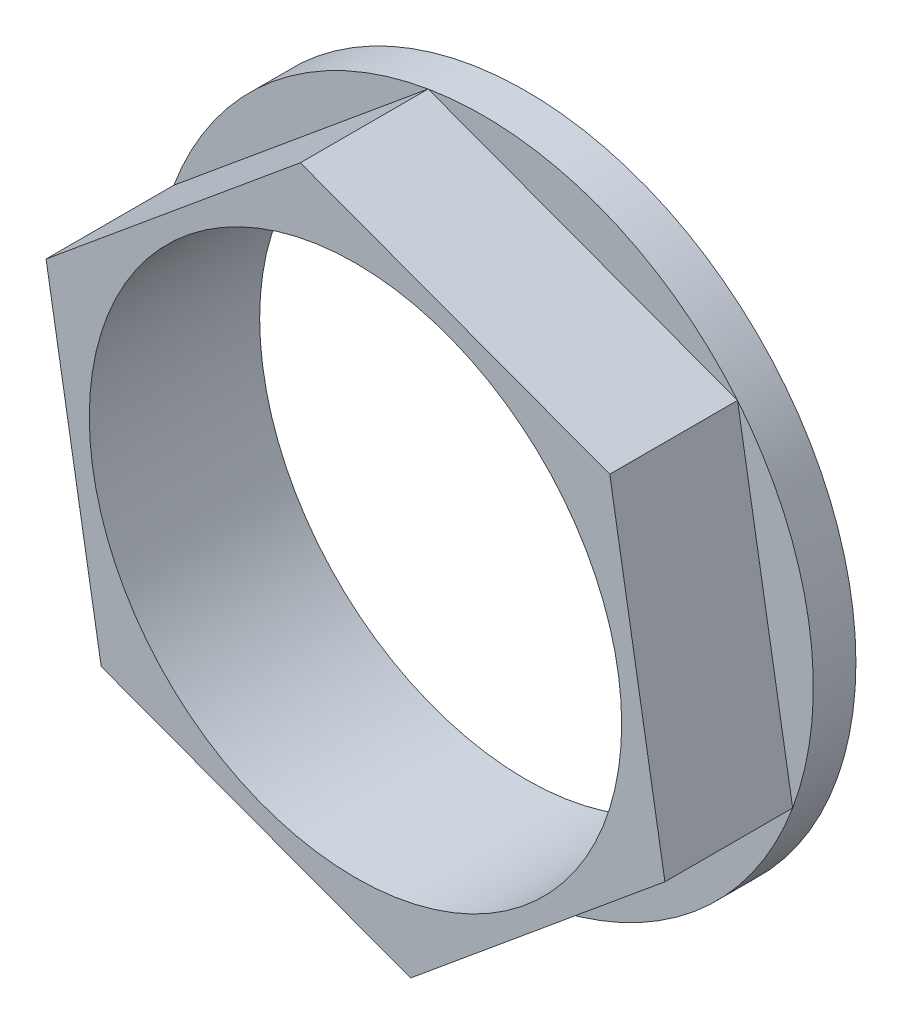
from build123d import *

# Parameters (mm, degrees)
ESBO_O1_R                = 7.75
ESBO_O1_R_2              = 6.25
RESSALTO_EXTRUS_O1_DEPTH = 1
ESBO_O2_R                = 6.25
RESSALTO_EXTRUS_O2_DEPTH = 3


with BuildPart() as part:
    # Esboço1 → Ressalto-extrusão1 (new body)
    with BuildSketch(Plane.XY):
        Circle(ESBO_O1_R)
        Circle(ESBO_O1_R_2, mode=Mode.SUBTRACT)
    extrude(amount=RESSALTO_EXTRUS_O1_DEPTH)

    # Esboço2 → Ressalto-extrusão2 (add)
    with BuildSketch(Plane.XY.offset(1)):
        Polygon((-7.264588002, 2.699677974), (-5.970283708, -4.941478771), (1.294304294, -7.641156745), (7.264588002, -2.699677974), (5.970283708, 4.941478771), (-1.294304294, 7.641156745), align=None)
        Circle(ESBO_O2_R, mode=Mode.SUBTRACT)
    extrude(amount=RESSALTO_EXTRUS_O2_DEPTH)


solid = part.part
